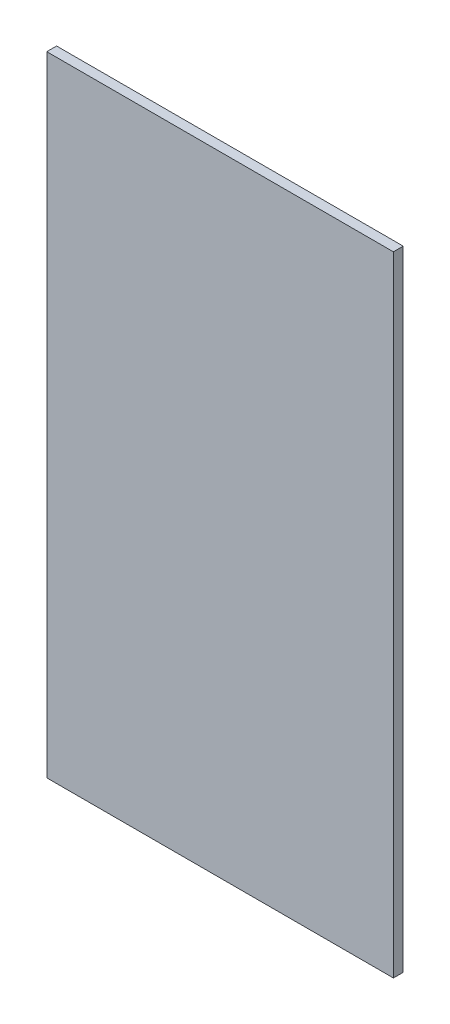
from build123d import *

# Parameters (mm, degrees)
SKETCH1_W           = 112
SKETCH1_H           = 203.2
BOSS_EXTRUDE1_DEPTH = 3.175


with BuildPart() as part:
    # Sketch1 → Boss-Extrude1 (new body)
    with BuildSketch(Plane.XY):
        with Locations((12.767221987, -60.820254238)):
            Rectangle(SKETCH1_W, SKETCH1_H)
    extrude(amount=BOSS_EXTRUDE1_DEPTH)


solid = part.part
